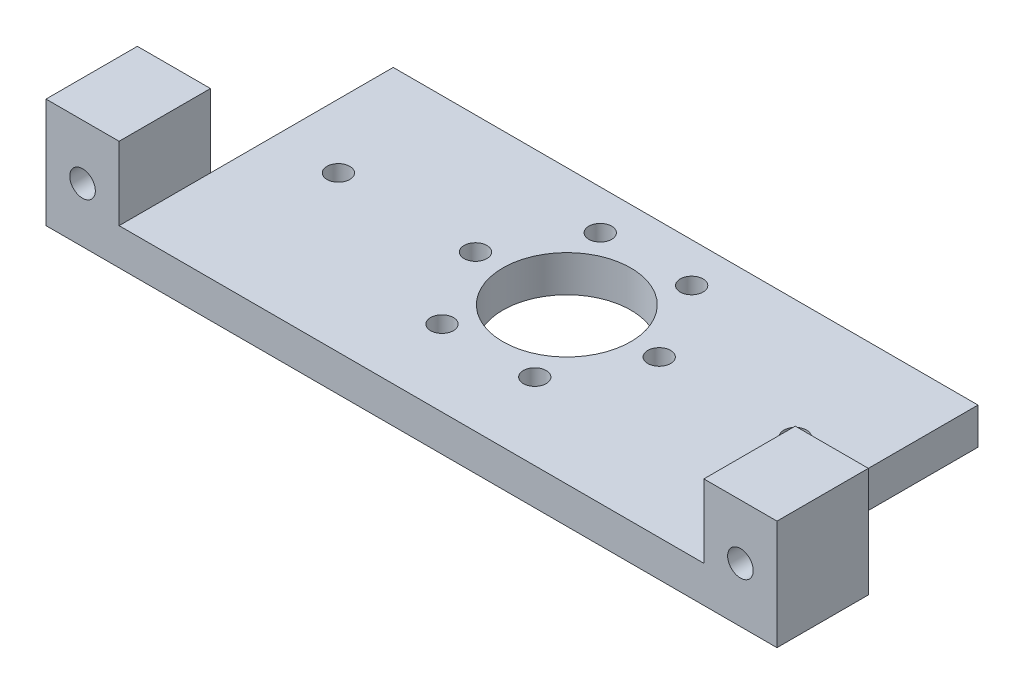
from build123d import *

# Parameters (mm, degrees)
SKETCH1_W                = 40
SKETCH1_H                = 15
BOSS_EXTRUDE1_DEPTH      = 2
SKETCH2_R                = 3.5
CUT_EXTRUDE1_DEPTH       = 2
SKETCH3_W                = 4
SKETCH3_H                = 15
BOSS_EXTRUDE2_DEPTH      = 4
SKETCH4_R                = 0.7
CUT_EXTRUDE2_DEPTH       = 63.0262757
M1_6X0_35_TAPPED_HOLE5_D = 1.25
SKETCH38_R               = 1
BOSS_EXTRUDE4_DEPTH      = 4
M1_6X0_35_TAPPED_HOLE9_D = 1.25
SKETCH41_W               = 4
SKETCH41_H               = 6
CUT_EXTRUDE3_DEPTH       = 10


with BuildPart() as part:
    # Sketch1 → Boss-Extrude1 (new body)
    with BuildSketch(Plane(origin=(0, 0, 0), x_dir=(1, 0, 0), z_dir=(0, 1, 0))):
        with Locations((-39.885381165, 7.155172414)):
            Rectangle(SKETCH1_W, SKETCH1_H)
    extrude(amount=BOSS_EXTRUDE1_DEPTH)

    # Sketch2 → Cut-Extrude1 (cut)
    with BuildSketch(Plane(origin=(0, 2, 0), x_dir=(1, 0, 0), z_dir=(0, 1, 0))):
        with Locations((-39.885381165, 8.155172414)):
            Circle(SKETCH2_R)
    extrude(amount=-CUT_EXTRUDE1_DEPTH, mode=Mode.SUBTRACT)

    # Sketch3 → Boss-Extrude2 (add)
    with BuildSketch(Plane(origin=(0, 2, 0), x_dir=(1, 0, 0), z_dir=(0, 1, 0))):
        with Locations((-57.885381165, 7.155172414)):
            Rectangle(SKETCH3_W, SKETCH3_H)
        with Locations((-21.885381165, 7.155172414)):
            Rectangle(SKETCH3_W, SKETCH3_H)
    extrude(amount=BOSS_EXTRUDE2_DEPTH)

    # Sketch4 → Cut-Extrude2 (cut, through all)
    with BuildSketch(Plane(origin=(0, 0, -14.655172414), x_dir=(-1, 0, 0), z_dir=(0, 0, -1))):
        with Locations((57.885381165, 3)):
            Circle(SKETCH4_R)
        with Locations((21.885381165, 3)):
            Circle(SKETCH4_R)
    extrude(amount=-CUT_EXTRUDE2_DEPTH, mode=Mode.SUBTRACT)

    # M1.6x0.35 Tapped Hole5 (through all)
    with Locations(Plane(origin=(0, 2, 0), x_dir=(1, 0, 0), z_dir=(0, 1, 0))):
        with Locations((-42.385381165, 3.825045395), (-44.885381165, 8.155172414), (-37.337826877, 3.852851279), (-34.885684623, 8.210258577), (-42.385381165, 12.485299433), (-37.385381165, 12.485299433)):
            Hole(M1_6X0_35_TAPPED_HOLE5_D / 2)

    # Sketch38 → Boss-Extrude4 (add)
    with BuildSketch(Plane(origin=(0, 2, 0), x_dir=(1, 0, 0), z_dir=(0, 1, 0))):
        with Locations((-52.385381165, 8.155172414)):
            Circle(SKETCH38_R)
        with Locations((-27.385381165, 8.155172414)):
            Circle(SKETCH38_R)
    extrude(amount=-BOSS_EXTRUDE4_DEPTH)

    # M1.6x0.35 Tapped Hole9 (through all)
    with Locations(Plane(origin=(0, -2, 0), x_dir=(-1, 0, 0), z_dir=(0, -1, 0))):
        with Locations((52.385381165, 8.155172414), (27.385381165, 8.155172414)):
            Hole(M1_6X0_35_TAPPED_HOLE9_D / 2)

    # Sketch41 → Cut-Extrude3 (cut)
    with BuildSketch(Plane(origin=(0, 0, -14.655172414), x_dir=(-1, 0, 0), z_dir=(0, 0, -1))):
        with Locations((57.885381165, 3)):
            Rectangle(SKETCH41_W, SKETCH41_H)
        with Locations((21.885381165, 3)):
            Rectangle(SKETCH41_W, SKETCH41_H)
    extrude(amount=-CUT_EXTRUDE3_DEPTH, mode=Mode.SUBTRACT)


solid = part.part
